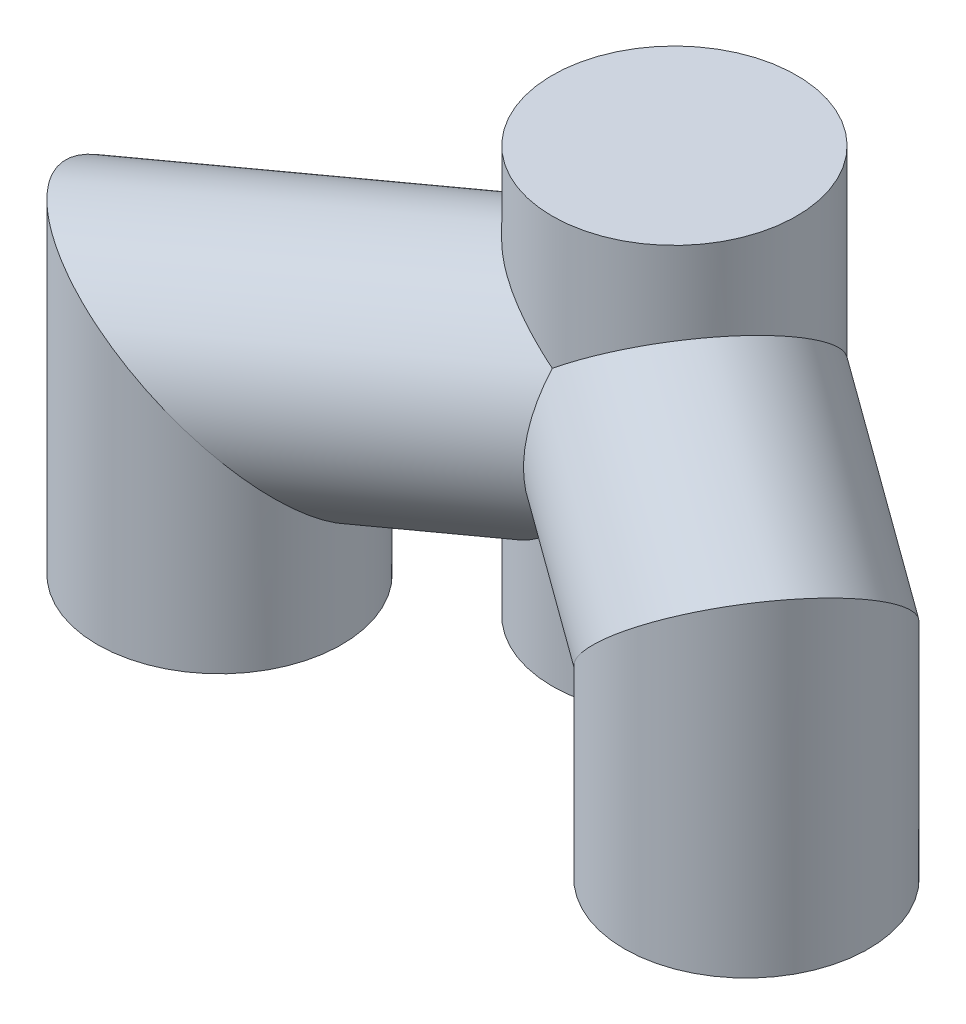
from build123d import *

# Parameters (mm, degrees)
SKETCH2_R           = 1.5
SKETCH5_R           = 1.5
SKETCH1_R           = 1.5
BOSS_EXTRUDE1_DEPTH = 5


with BuildPart() as part:
    # Sweep1: sweep along a path in Sketch3
    with BuildLine(Plane(origin=(0, 0, 0), x_dir=(-0.8090169943749461, 0, 0.5877852522924749), z_dir=(-0.5877852522924749, 0, -0.8090169943749461))) as sweep1_path:
        Line((4, 0), (4, 2.5))
        Line((4, 2.5), (0, 2.5))
    # Sketch2 → Sweep1 (sweep)
    with BuildSketch(Plane(origin=(0, 0, 0), x_dir=(1, 0, 0), z_dir=(0, 1, 0))):
        with Locations((-3.236067977, -2.351141009)):
            Circle(SKETCH2_R)
    sweep(path=sweep1_path.line, transition=Transition.RIGHT)

    # Sweep2: sweep along a path in Sketch6
    with BuildLine(Plane(origin=(0, 0, 0), x_dir=(0.8090169943749507, 0, 0.5877852522924687), z_dir=(-0.5877852522924687, 0, 0.8090169943749507))) as sweep2_path:
        Line((4, 0), (4, 2.5))
        Line((4, 2.5), (0, 2.5))
    # Sketch5 → Sweep2 (sweep)
    with BuildSketch(Plane(origin=(0, 0, 0), x_dir=(1, 0, 0), z_dir=(0, 1, 0))):
        with Locations((3.236067977, -2.351141009)):
            Circle(SKETCH5_R)
    sweep(path=sweep2_path.line, transition=Transition.RIGHT)

    # Sketch1 → Boss-Extrude1 (add)
    with BuildSketch(Plane(origin=(0, 0, 0), x_dir=(1, 0, 0), z_dir=(0, 1, 0))):
        with Locations(Location((0, 0, 0), (0, 0, 270))):
            Circle(SKETCH1_R)
    extrude(amount=BOSS_EXTRUDE1_DEPTH)


solid = part.part
